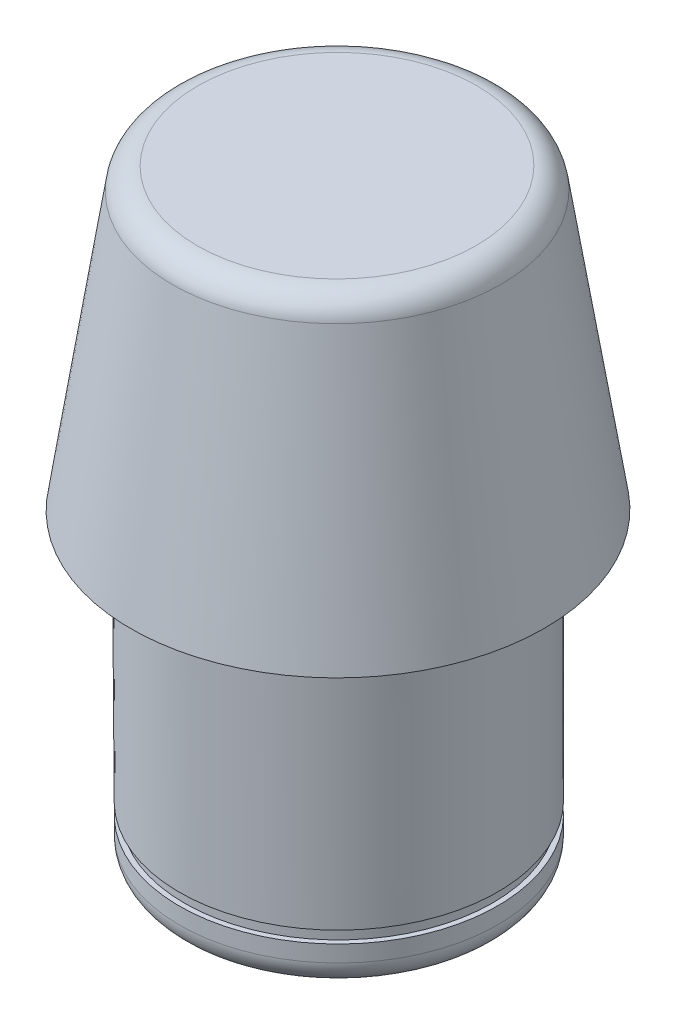
from build123d import *


with BuildPart() as part:
    # Sketch2 → Revolve1 (revolve)
    with BuildSketch(Plane.XY, mode=Mode.PRIVATE) as revolve1_sk:
        with BuildLine():
            Line((0, 0), (6.7564, 0))
            ThreePointArc((6.7564, 0), (7.654425612, 0.371974388), (8.0264, 1.27))
            Line((8.0264, 1.27), (8.0264, 2.102867264))
            Line((8.0264, 2.102867264), (7.7724, 2.102867264))
            Line((7.7724, 2.102867264), (7.7724, 2.709800424))
            Line((7.7724, 2.709800424), (8.0264, 2.709800424))
            Line((8.0264, 2.709800424), (8.0264, 13.97))
            Line((8.0264, 13.97), (10.387716219, 15.438949013))
            Line((10.387716219, 15.438949013), (8.194857048, 29.406966649))
            ThreePointArc((8.194857048, 29.406966649), (7.765679113, 30.175154818), (6.940223979, 30.48))
            Line((6.940223979, 30.48), (-0.1016, 30.48))
            Line((-0.1016, 30.48), (0, 0))
        make_face()
    revolve(revolve1_sk.sketch.rotate(Axis((-0.1016, 30.48, 0), (0.0033333148149691442, -0.9999944444907404, 0)), 180), axis=Axis((-0.1016, 30.48, 0), (0.0033333148149691442, -0.9999944444907404, 0)))


solid = part.part
